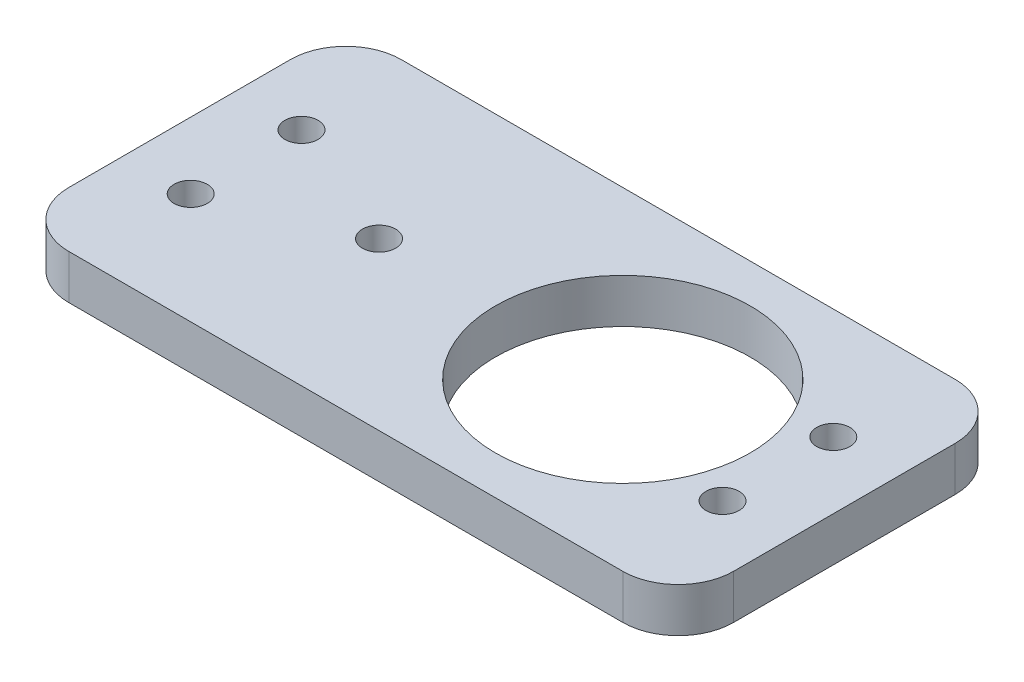
from build123d import *

# Parameters (mm, degrees)
SKETCH_1_W          = 60
SKETCH_1_H          = 30
EXTRUDE_1_DEPTH     = 4
SKETCH_2_R          = 1.5
CUT_EXTRUDE_1_DEPTH = 4
SKETCH_3_R          = 11.5
CUT_EXTRUDE_2_DEPTH = 4
SKETCH_4_R          = 1.5
CUT_EXTRUDE_3_DEPTH = 4
FILLET_1_R          = 5


with BuildPart() as part:
    # 草图1 → 凸台-拉伸1 (new body)
    with BuildSketch(Plane(origin=(0, 0, 0), x_dir=(1, 0, 0), z_dir=(0, 1, 0))):
        Rectangle(SKETCH_1_W, SKETCH_1_H)
    extrude(amount=EXTRUDE_1_DEPTH)

    # 草图2 → 切除-拉伸1 (cut)
    with BuildSketch(Plane(origin=(0, 4, 0), x_dir=(1, 0, 0), z_dir=(0, 1, 0))):
        with Locations(Location((-24, 5, 0), (0, 0, 270))):
            Circle(SKETCH_2_R)
        with Locations(Location((-24, -5, 0), (0, 0, 270))):
            Circle(SKETCH_2_R)
        with Locations(Location((24, -5, 0), (0, 0, 270))):
            Circle(SKETCH_2_R)
        with Locations(Location((24, 5, 0), (0, 0, 270))):
            Circle(SKETCH_2_R)
    extrude(amount=-CUT_EXTRUDE_1_DEPTH, mode=Mode.SUBTRACT)

    # 草图3 → 切除-拉伸2 (cut)
    with BuildSketch(Plane(origin=(0, 4, 0), x_dir=(1, 0, 0), z_dir=(0, 1, 0))):
        with Locations(Location((10, 0, 0), (0, 0, 270))):
            Circle(SKETCH_3_R)
    extrude(amount=-CUT_EXTRUDE_2_DEPTH, mode=Mode.SUBTRACT)

    # 草图4 → 切除-拉伸3 (cut)
    with BuildSketch(Plane(origin=(0, 4, 0), x_dir=(1, 0, 0), z_dir=(0, 1, 0))):
        with Locations(Location((-12, 0, 0), (0, 0, 270))):
            Circle(SKETCH_4_R)
    extrude(amount=-CUT_EXTRUDE_3_DEPTH, mode=Mode.SUBTRACT)

    # 圆角1
    fillet_1_edges = [part.edges().sort_by_distance(p)[0] for p in [
        (30, 2, 15),
        (-30, 2, 15),
        (-30, 2, -15),
        (30, 2, -15),
    ]]
    fillet(fillet_1_edges, radius=FILLET_1_R)


solid = part.part
